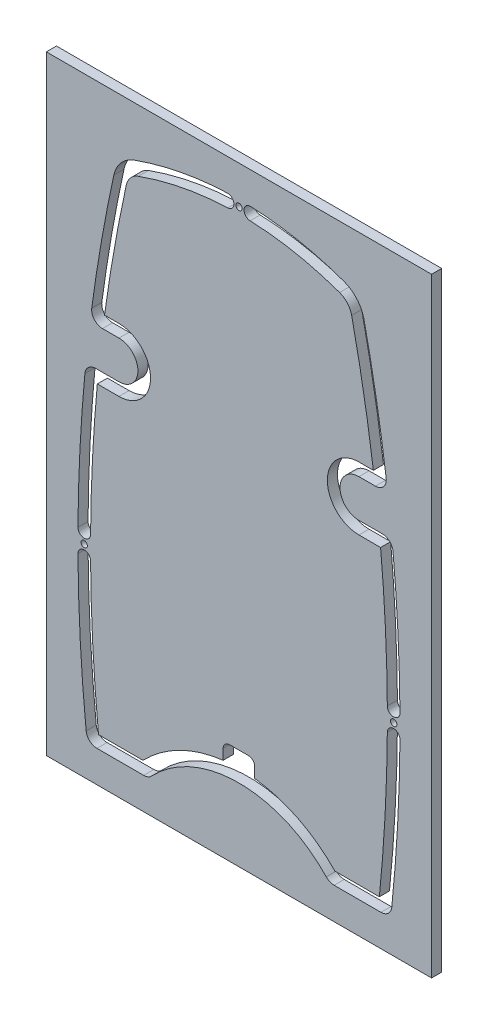
from build123d import *

# Parameters (mm, degrees)
SKIZZE1_W                       = 61
SKIZZE1_H                       = 96.5
SKIZZE1_R                       = 0.5
AUFSATZ_LINEAR_AUSTRAGEN1_DEPTH = 1.6


with BuildPart() as part:
    # Skizze1 → Aufsatz-Linear austragen1 (new body)
    with BuildSketch(Plane.XY):
        with Locations((0, -11.75)):
            Rectangle(SKIZZE1_W, SKIZZE1_H)
        with Locations((0, 30.5)):
            Circle(SKIZZE1_R, mode=Mode.SUBTRACT)
        with Locations((-24.5, -28)):
            Circle(SKIZZE1_R, mode=Mode.SUBTRACT)
        with Locations((24.5, -28)):
            Circle(SKIZZE1_R, mode=Mode.SUBTRACT)
        with BuildLine():
            Line((-22.231560855, -53), (-15.190457531, -53))
            ThreePointArc((-15.190457531, -53), (-9.397914174, -48.720244698), (-2.5, -46.649340538))
            Line((-2.5, -46.649340538), (-2.5, -45))
            ThreePointArc((-2.5, -45), (-2.207106781, -44.292893219), (-1.5, -44))
            Line((-1.5, -44), (1.5, -44))
            ThreePointArc((1.5, -44), (2.207106781, -44.292893219), (2.5, -45))
            Line((2.5, -45), (2.5, -46.649340538))
            ThreePointArc((2.5, -46.649340538), (9.397914174, -48.720244698), (15.190457531, -53))
            Line((15.190457531, -53), (22.231560855, -53))
            ThreePointArc((22.231560855, -53), (23.135640421, -41.41122194), (23.493493996, -29.792741935))
            ThreePointArc((23.493493996, -29.792741935), (24.50072572, -28.80002634), (25.493441316, -29.807258065))
            ThreePointArc((25.493441316, -29.807258065), (25.125648184, -41.648701954), (24.195027533, -53.459248528))
            ThreePointArc((24.195027533, -53.459248528), (23.637637029, -54.557859223), (22.487793054, -55))
            Line((22.487793054, -55), (15.068542623, -55))
            ThreePointArc((15.068542623, -55), (14.388773301, -54.859637633), (13.820194306, -54.461509699))
            ThreePointArc((13.820194306, -54.461509699), (0, -48.5), (-13.820194306, -54.461509699))
            ThreePointArc((-13.820194306, -54.461509699), (-14.388773301, -54.859637633), (-15.068542623, -55))
            Line((-15.068542623, -55), (-22.487793054, -55))
            ThreePointArc((-22.487793054, -55), (-23.637637029, -54.557859223), (-24.195027533, -53.459248528))
            ThreePointArc((-24.195027533, -53.459248528), (-25.125648184, -41.648701954), (-25.493441316, -29.807258065))
            ThreePointArc((-25.493441316, -29.807258065), (-24.50072572, -28.80002634), (-23.493493996, -29.792741935))
            ThreePointArc((-23.493493996, -29.792741935), (-23.135640421, -41.41122194), (-22.231560855, -53))
        make_face(mode=Mode.SUBTRACT)
        with BuildLine():
            Line((-19, 5), (-21.285620493, 5))
            ThreePointArc((-21.285620493, 5), (-19.763470557, 14.80051276), (-17.849098235, 24.532016724))
            ThreePointArc((-17.849098235, 24.532016724), (-17.173923296, 25.871247857), (-15.934850806, 26.716292583))
            ThreePointArc((-15.934850806, 26.716292583), (-8.95491897, 28.639022814), (-1.7625, 29.466941499))
            ThreePointArc((-1.7625, 29.466941499), (-0.800703372, 30.503738126), (-1.8375, 31.465534754))
            ThreePointArc((-1.8375, 31.465534754), (-9.335979351, 30.602385487), (-16.612929564, 28.597836948))
            ThreePointArc((-16.612929564, 28.597836948), (-18.67805038, 27.189429071), (-19.803341946, 24.957377183))
            ThreePointArc((-19.803341946, 24.957377183), (-21.761478169, 14.986129467), (-23.311141633, 4.943290145))
            ThreePointArc((-23.311141633, 4.943290145), (-22.901341819, 3.585796991), (-21.609999326, 3))
            Line((-21.609999326, 3), (-19, 3))
            ThreePointArc((-19, 3), (-16, 0), (-19, -3))
            Line((-19, -3), (-22.685152712, -3))
            ThreePointArc((-22.685152712, -3), (-23.84016455, -3.446823778), (-24.39375693, -4.554632116))
            ThreePointArc((-24.39375693, -4.554632116), (-25.179058013, -15.361720617), (-25.493441316, -26.192741935))
            ThreePointArc((-25.493441316, -26.192741935), (-24.50072572, -27.19997366), (-23.493493996, -26.207258065))
            ThreePointArc((-23.493493996, -26.207258065), (-23.188154433, -15.592161252), (-22.426818383, -5))
            Line((-22.426818383, -5), (-19, -5))
            ThreePointArc((-19, -5), (-14, 0), (-19, 5))
        make_face(mode=Mode.SUBTRACT)
        with BuildLine():
            Line((19, 5), (21.285620493, 5))
            ThreePointArc((21.285620493, 5), (19.763470557, 14.80051276), (17.849098235, 24.532016724))
            ThreePointArc((17.849098235, 24.532016724), (17.173923296, 25.871247857), (15.934850806, 26.716292583))
            ThreePointArc((15.934850806, 26.716292583), (8.95491897, 28.639022814), (1.7625, 29.466941499))
            ThreePointArc((1.7625, 29.466941499), (0.800703372, 30.503738126), (1.8375, 31.465534754))
            ThreePointArc((1.8375, 31.465534754), (9.335979351, 30.602385487), (16.612929564, 28.597836948))
            ThreePointArc((16.612929564, 28.597836948), (18.67805038, 27.189429071), (19.803341946, 24.957377183))
            ThreePointArc((19.803341946, 24.957377183), (21.761478169, 14.986129467), (23.311141633, 4.943290145))
            ThreePointArc((23.311141633, 4.943290145), (22.901341819, 3.585796991), (21.609999326, 3))
            Line((21.609999326, 3), (19, 3))
            ThreePointArc((19, 3), (16, 0), (19, -3))
            Line((19, -3), (22.685152712, -3))
            ThreePointArc((22.685152712, -3), (23.84016455, -3.446823778), (24.39375693, -4.554632116))
            ThreePointArc((24.39375693, -4.554632116), (25.179058013, -15.361720617), (25.493441316, -26.192741935))
            ThreePointArc((25.493441316, -26.192741935), (24.50072572, -27.19997366), (23.493493996, -26.207258065))
            ThreePointArc((23.493493996, -26.207258065), (23.188154433, -15.592161252), (22.426818383, -5))
            Line((22.426818383, -5), (19, -5))
            ThreePointArc((19, -5), (14, 0), (19, 5))
        make_face(mode=Mode.SUBTRACT)
    extrude(amount=AUFSATZ_LINEAR_AUSTRAGEN1_DEPTH)


solid = part.part
